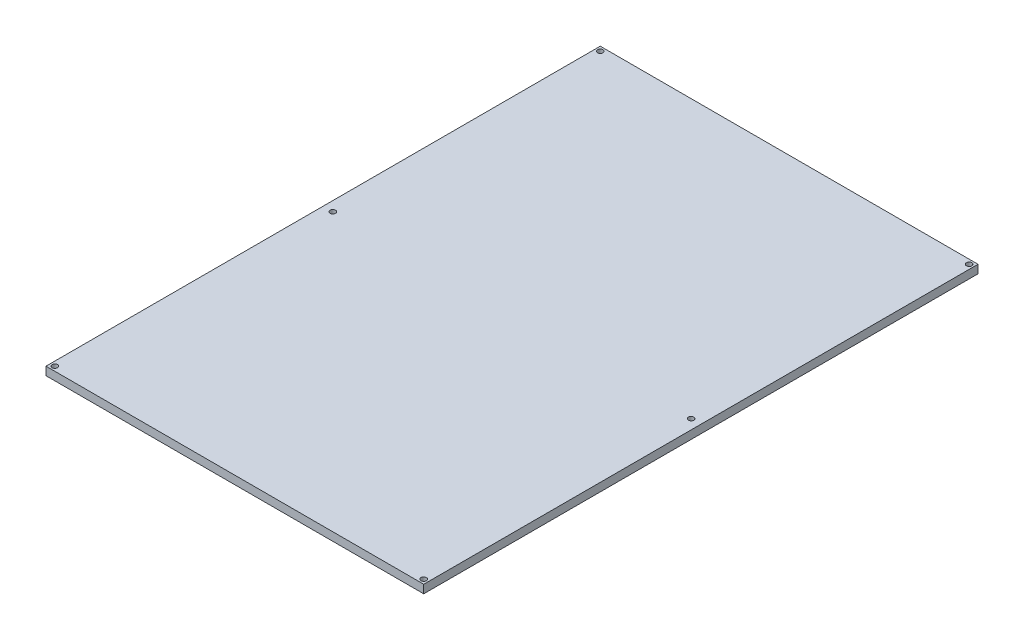
from build123d import *

# Parameters (mm, degrees)
CROQUIS1_W              = 214
CROQUIS1_H              = 314
CROQUIS1_R              = 1.55
SALIENTE_EXTRUIR1_DEPTH = 4.7


with BuildPart() as part:
    # Croquis1 → Saliente-Extruir1 (new body)
    with BuildSketch(Plane(origin=(0, 0, 0), x_dir=(1, 0, 0), z_dir=(0, 1, 0))):
        with Locations((107, 157)):
            Rectangle(CROQUIS1_W, CROQUIS1_H)
        with Locations(Location((2.5, 311.5, 0), (0, 0, 270))):
            Circle(CROQUIS1_R, mode=Mode.SUBTRACT)
        with Locations(Location((211.5, 311.5, 0), (0, 0, 90))):
            Circle(CROQUIS1_R, mode=Mode.SUBTRACT)
        with Locations(Location((2.5, 2.5, 0), (0, 0, 90))):
            Circle(CROQUIS1_R, mode=Mode.SUBTRACT)
        with Locations(Location((211.5, 2.5, 0), (0, 0, 270))):
            Circle(CROQUIS1_R, mode=Mode.SUBTRACT)
        with Locations(Location((5.5, 157, 0), (0, 0, 270))):
            Circle(CROQUIS1_R, mode=Mode.SUBTRACT)
        with Locations(Location((208.5, 157, 0), (0, 0, 90))):
            Circle(CROQUIS1_R, mode=Mode.SUBTRACT)
    extrude(amount=SALIENTE_EXTRUIR1_DEPTH)


solid = part.part
